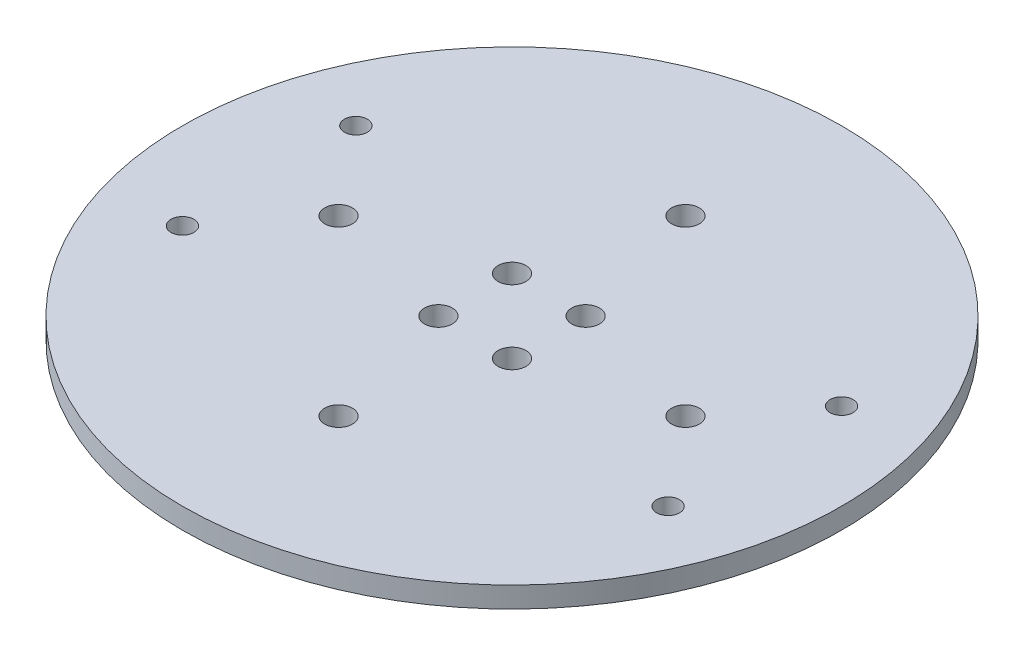
from build123d import *

# Parameters (mm, degrees)
SKETCH_1_R      = 47.5
SKETCH_1_R_2    = 2
SKETCH_1_R_3    = 1.65
EXTRUDE_1_DEPTH = 3


with BuildPart() as part:
    # ｽｹｯﾁ1 → ﾎﾞｽ - 押し出し1 (new body)
    with BuildSketch(Plane(origin=(0, 0, 0), x_dir=(1, 0, 0), z_dir=(0, 1, 0))):
        with Locations(Location((0, 0, 0), (0, 0, 270))):
            Circle(SKETCH_1_R)
        with Locations(Location((5.303300859, 5.303300859, 0), (0, 0, 270))):
            Circle(SKETCH_1_R_2, mode=Mode.SUBTRACT)
        with Locations(Location((5.303300859, -5.303300859, 0), (0, 0, 270))):
            Circle(SKETCH_1_R_2, mode=Mode.SUBTRACT)
        with Locations(Location((-5.303300859, -5.303300859, 0), (0, 0, 270))):
            Circle(SKETCH_1_R_2, mode=Mode.SUBTRACT)
        with Locations(Location((-5.303300859, 5.303300859, 0), (0, 0, 270))):
            Circle(SKETCH_1_R_2, mode=Mode.SUBTRACT)
        with Locations(Location((25, 0, 0), (0, 0, 270))):
            Circle(SKETCH_1_R_2, mode=Mode.SUBTRACT)
        with Locations(Location((0, -25, 0), (0, 0, 270))):
            Circle(SKETCH_1_R_2, mode=Mode.SUBTRACT)
        with Locations(Location((-25, 0, 0), (0, 0, 270))):
            Circle(SKETCH_1_R_2, mode=Mode.SUBTRACT)
        with Locations(Location((0, 25, 0), (0, 0, 270))):
            Circle(SKETCH_1_R_2, mode=Mode.SUBTRACT)
        with Locations(Location((35, 12.5, 0), (0, 0, 270))):
            Circle(SKETCH_1_R_3, mode=Mode.SUBTRACT)
        with Locations(Location((35, -12.5, 0), (0, 0, 270))):
            Circle(SKETCH_1_R_3, mode=Mode.SUBTRACT)
        with Locations(Location((-35, -12.5, 0), (0, 0, 270))):
            Circle(SKETCH_1_R_3, mode=Mode.SUBTRACT)
        with Locations(Location((-35, 12.5, 0), (0, 0, 270))):
            Circle(SKETCH_1_R_3, mode=Mode.SUBTRACT)
    extrude(amount=EXTRUDE_1_DEPTH)


solid = part.part
